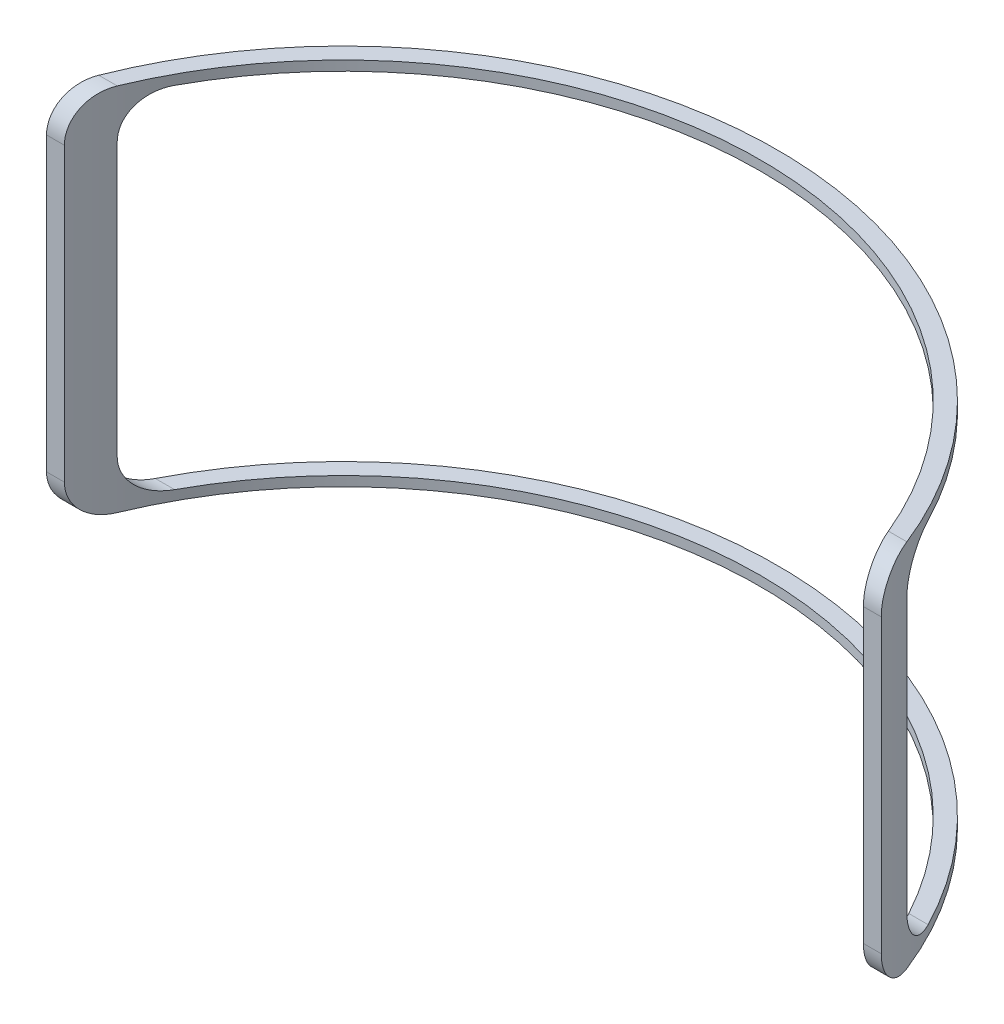
from build123d import *

# Parameters (mm, degrees)
BOSS_EXTRUDE2_DEPTH = 950
FILLET2_R           = 100
CUT_EXTRUDE3_DEPTH  = 900
FILLET3_R           = 100


with BuildPart() as part:
    # Sketch2 → Boss-Extrude2 (new body)
    with BuildSketch(Plane(origin=(0, 0, 0), x_dir=(1, 0, 0), z_dir=(0, 1, 0))):
        with BuildLine():
            Line((2122.868885508, -17), (2076.979866157, -17))
            ThreePointArc((2076.979866157, -17), (1050, 745.128073785), (23.020133843, -17))
            Line((23.020133843, -17), (-22.868885508, -17))
            ThreePointArc((-22.868885508, -17), (1050, 789.128073785), (2122.868885508, -17))
        make_face()
    extrude(amount=BOSS_EXTRUDE2_DEPTH)

    # Fillet2
    fillet2_edges = [part.edges().sort_by_distance(p)[0] for p in [
        (2099.924375832, 950, 17),
        (0.075624168, 950, 17),
        (2099.924375832, 0, 17),
        (0.075624168, 0, 17),
    ]]
    fillet(fillet2_edges, radius=FILLET2_R)

    # Sketch4 → Cut-Extrude3 (cut)
    with BuildSketch(Plane(origin=(0, 25, 0), x_dir=(-1, 0, 0), z_dir=(0, -1, 0))):
        with BuildLine():
            Line((-2088.688240161, 83), (-2041.218068968, 83))
            ThreePointArc((-2041.218068968, 83), (-1050, 745.128073785), (-58.781931032, 83))
            Line((-58.781931032, 83), (-11.311759839, 83))
            ThreePointArc((-11.311759839, 83), (-1050, 789.128073785), (-2088.688240161, 83))
        make_face()
    extrude(amount=-CUT_EXTRUDE3_DEPTH, mode=Mode.SUBTRACT)

    # Fillet3
    fillet3_edges = [part.edges().sort_by_distance(p)[0] for p in [
        (35.046845436, 925, -83),
        (2064.953154564, 925, -83),
        (2064.953154564, 25, -83),
        (35.046845436, 25, -83),
    ]]
    fillet(fillet3_edges, radius=FILLET3_R)


solid = part.part
